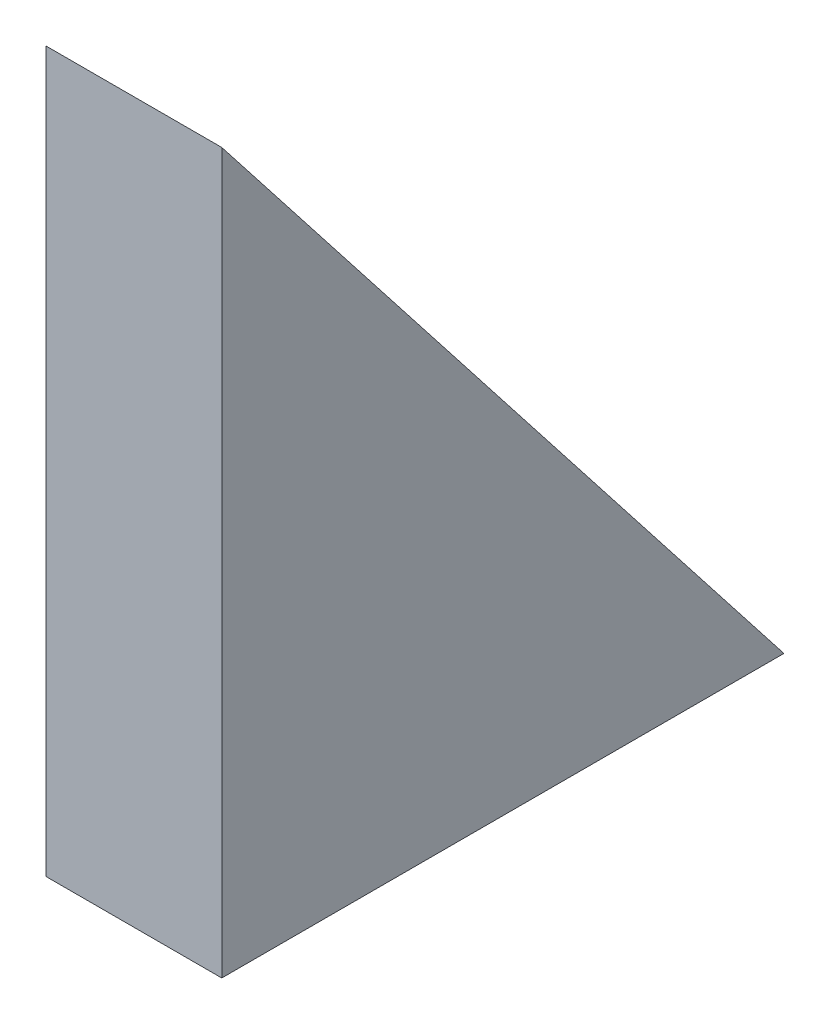
from build123d import *

# Parameters (mm, degrees)
BOSS_EXTRUDE1_DEPTH = 7.9375


with BuildPart() as part:
    # Sketch1 → Boss-Extrude1 (new, symmetric)
    with BuildSketch(Plane(origin=(0, 0, 0), x_dir=(0, 0, -1), z_dir=(1, 0, 0))):
        Polygon((0, 0), (0, 65), (50.8, 0), align=None)
    extrude(amount=BOSS_EXTRUDE1_DEPTH, both=True)


solid = part.part
